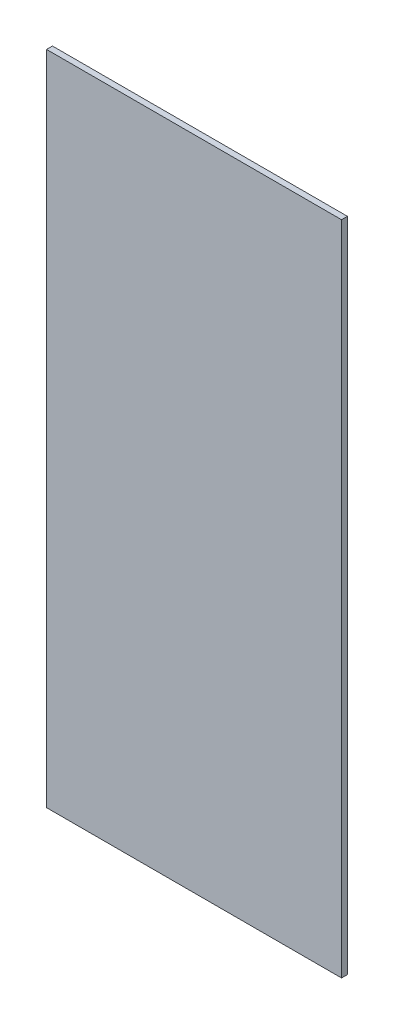
from build123d import *

# Parameters (mm, degrees)
SKETCH_2_W      = 1000
SKETCH_2_H      = 2226
EXTRUDE_1_DEPTH = 20


with BuildPart() as part:
    # Эскиз2 → Бобышка-Вытянуть1 (new body)
    with BuildSketch(Plane.XY):
        with Locations((500, 1113)):
            Rectangle(SKETCH_2_W, SKETCH_2_H)
    extrude(amount=EXTRUDE_1_DEPTH)


solid = part.part
